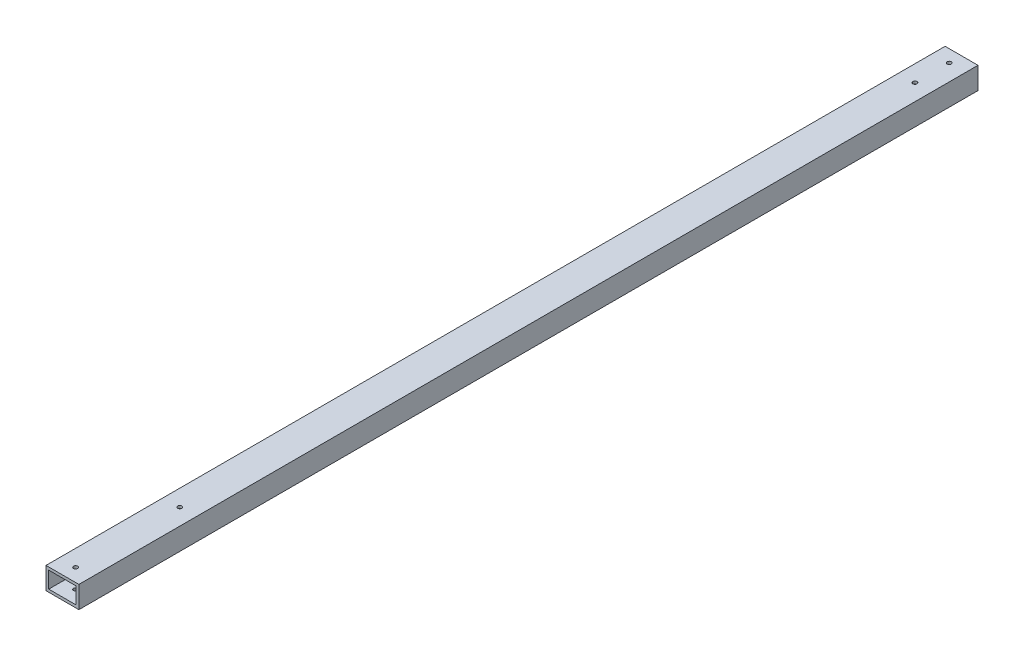
from build123d import *

# Parameters (mm, degrees)
BOSS_EXTRUDE1_DEPTH      = 520.7
BOSS_EXTRUDE1_DEPTH_BACK = 520.7
SKETCH1_W                = 38.1
SKETCH1_H                = 25.4
SKETCH1_W_2              = 31.75
SKETCH1_H_2              = 19.05
SKETCH2_R                = 2.38125
CUT_EXTRUDE1_DEPTH       = 520.7
SKETCH3_R                = 2.38125
CUT_EXTRUDE2_DEPTH       = 100


with BuildPart() as part:
    # Sketch1 → Boss-Extrude1 (new, two sides: drawn at the far end of the back side and taken through both)
    with BuildSketch(Plane.XY.offset(-BOSS_EXTRUDE1_DEPTH_BACK)):
        Rectangle(SKETCH1_W, SKETCH1_H)
        Rectangle(SKETCH1_W_2, SKETCH1_H_2, mode=Mode.SUBTRACT)
    extrude(amount=BOSS_EXTRUDE1_DEPTH + BOSS_EXTRUDE1_DEPTH_BACK)

    # Sketch2 → Cut-Extrude1 (cut)
    with BuildSketch(Plane(origin=(0, 12.7, 0), x_dir=(1, 0, 0), z_dir=(0, 1, 0))):
        with Locations(Location((0, -384.81, 0), (0, 0, 180))):
            Circle(SKETCH2_R)
        with Locations(Location((0, -505.46, 0), (0, 0, 180))):
            Circle(SKETCH2_R)
    extrude(amount=-CUT_EXTRUDE1_DEPTH, mode=Mode.SUBTRACT)

    # Sketch3 → Cut-Extrude2 (cut)
    with BuildSketch(Plane(origin=(0, 12.7, 0), x_dir=(1, 0, 0), z_dir=(0, 1, 0))):
        with Locations(Location((0, 506.4125, 0), (0, 0, 180))):
            Circle(SKETCH3_R)
        with Locations(Location((0, 466.725, 0), (0, 0, 180))):
            Circle(SKETCH3_R)
    extrude(amount=-CUT_EXTRUDE2_DEPTH, mode=Mode.SUBTRACT)


solid = part.part
